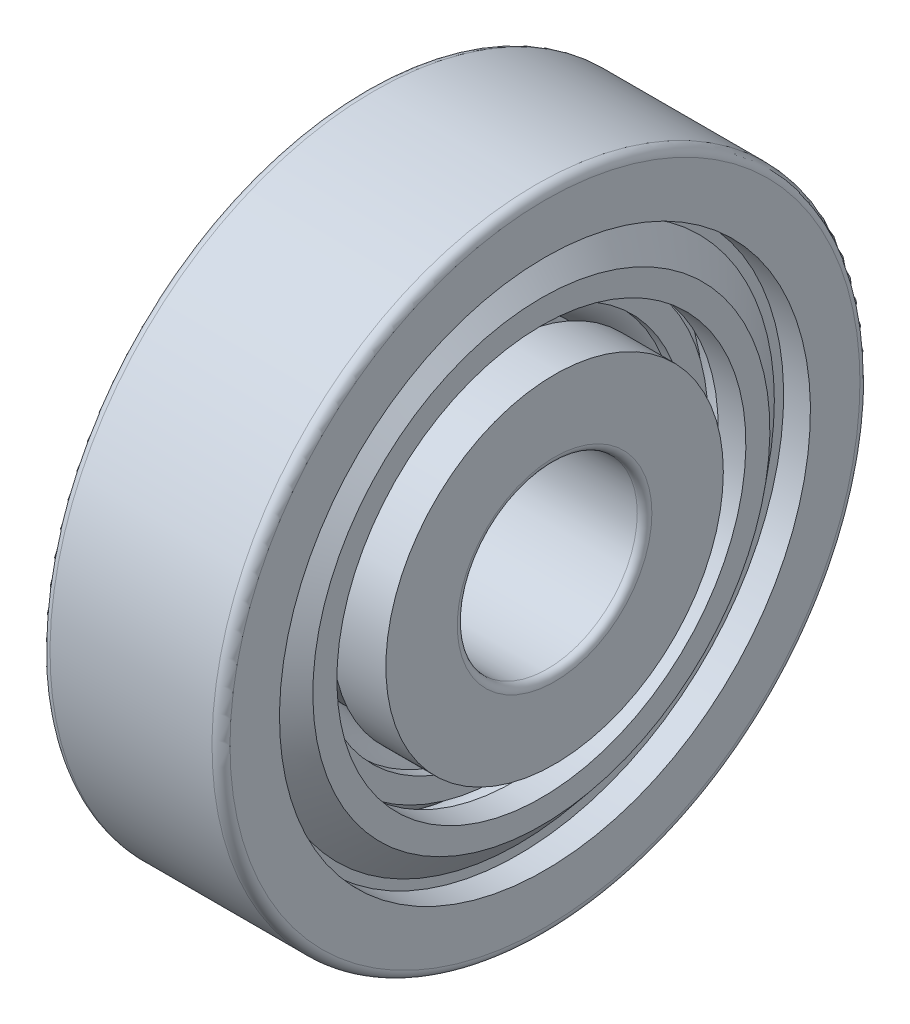
from build123d import *


with BuildPart() as part:
    # Sketch3 → Revolve2 (revolve)
    with BuildSketch(Plane.XY):
        with BuildLine():
            Line((-3.105243619, 14.049375), (-1.700552645, 14.049375))
            ThreePointArc((-1.700552645, 14.049375), (0, 14.76375), (1.700552645, 14.049375))
            Line((1.700552645, 14.049375), (3.105243619, 14.049375))
            Line((3.105243619, 14.049375), (3.105243619, 10.82278125))
            Line((3.105243619, 10.82278125), (4.572, 10.82278125))
            Line((4.572, 10.82278125), (4.572, 12.093421012))
            Line((4.572, 12.093421012), (3.343368619, 13.557646875))
            Line((3.343368619, 13.557646875), (3.343368619, 14.049375))
            Line((3.343368619, 14.049375), (4.7625, 14.049375))
            Line((4.7625, 14.049375), (4.7625, 16.66875))
            ThreePointArc((4.7625, 16.66875), (4.623009605, 17.005509605), (4.28625, 17.145))
            Line((4.28625, 17.145), (-4.28625, 17.145))
            ThreePointArc((-4.28625, 17.145), (-4.623009605, 17.005509605), (-4.7625, 16.66875))
            Line((-4.7625, 16.66875), (-4.7625, 14.049375))
            Line((-4.7625, 14.049375), (-3.343368619, 14.049375))
            Line((-3.343368619, 14.049375), (-3.343368619, 13.557646875))
            Line((-3.343368619, 13.557646875), (-4.572, 12.093421012))
            Line((-4.572, 12.093421012), (-4.572, 10.82278125))
            Line((-4.572, 10.82278125), (-3.105243619, 10.82278125))
            Line((-3.105243619, 10.82278125), (-3.105243619, 14.049375))
        make_face()
    revolve(axis=Axis((-4.7625, 0, 0), (1, 0, 0)))


with BuildPart() as body_2:
    # Sketch5 → Revolve3 (revolve)
    with BuildSketch(Plane.XY, mode=Mode.PRIVATE) as revolve3_sk:
        with BuildLine():
            Line((5.271161056, 8.9296875), (2.434449285, 8.9296875))
            ThreePointArc((2.434449285, 8.9296875), (0.50866104, 7.963397471), (-1.417127204, 8.9296875))
            Line((-1.417127204, 8.9296875), (-4.253838976, 8.9296875))
            Line((-4.253838976, 8.9296875), (-4.253530832, 5.159342564))
            ThreePointArc((-4.253530832, 5.159342564), (-4.137277369, 4.878730529), (-3.856655833, 4.7625))
            Line((-3.856655833, 4.7625), (4.884119974, 4.7625))
            ThreePointArc((4.884119974, 4.7625), (5.158028978, 4.875963381), (5.271469973, 5.149881657))
            Line((5.271469973, 5.149881657), (5.271161056, 8.9296875))
        make_face()
    revolve(revolve3_sk.sketch.rotate(Axis((-3.96875, 0, 0), (1, 0, 0)), 270), axis=Axis((-3.96875, 0, 0), (1, 0, 0)))


with BuildPart() as body_3:
    # Sketch7 → Revolve4 (revolve)
    with BuildSketch(Plane.XY, mode=Mode.PRIVATE) as revolve4_sk:
        with BuildLine():
            Line((1.892973102, 9.723437498), (2.480468749, 9.723437506))
            Line((2.480468749, 9.723437506), (2.480468749, 10.914062506))
            Line((2.480468749, 10.914062506), (1.892973102, 10.914062504))
            ThreePointArc((1.892973102, 10.914062504), (-2e-09, 12.303125001), (-1.892973103, 10.9140625))
            Line((-1.892973103, 10.9140625), (-2.480468751, 10.9140625))
            Line((-2.480468751, 10.9140625), (-2.480468751, 9.7234375))
            Line((-2.480468751, 9.7234375), (-1.892973103, 9.723437502))
            ThreePointArc((-1.892973103, 9.723437502), (-2e-09, 8.334375), (1.892973102, 9.723437498))
        make_face()
    revolve(revolve4_sk.sketch.rotate(Axis((-2.48046875, 0, 0), (1, 0, 0)), 270), axis=Axis((-2.48046875, 0, 0), (1, 0, 0)))


solid = Compound([part.part, body_2.part, body_3.part])
